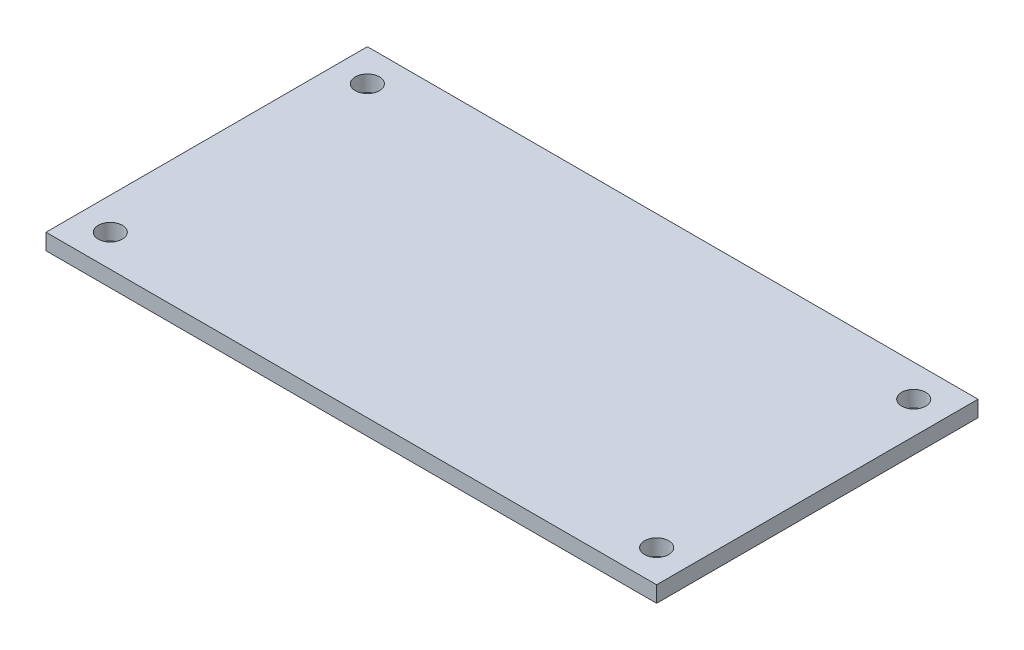
from build123d import *

# Parameters (mm, degrees)
SKETCH_1_W      = 76
SKETCH_1_H      = 40
SKETCH_1_R      = 1.5
EXTRUDE_1_DEPTH = 2


with BuildPart() as part:
    # 草图1 → 凸台-拉伸1 (new body)
    with BuildSketch(Plane(origin=(0, 0, 0), x_dir=(1, 0, 0), z_dir=(0, 1, 0))):
        Rectangle(SKETCH_1_W, SKETCH_1_H)
        with Locations(Location((34, 16, 0), (0, 0, 270))):
            Circle(SKETCH_1_R, mode=Mode.SUBTRACT)
        with Locations(Location((34, -16, 0), (0, 0, 90))):
            Circle(SKETCH_1_R, mode=Mode.SUBTRACT)
        with Locations(Location((-34, -16, 0), (0, 0, 270))):
            Circle(SKETCH_1_R, mode=Mode.SUBTRACT)
        with Locations(Location((-34, 16, 0), (0, 0, 90))):
            Circle(SKETCH_1_R, mode=Mode.SUBTRACT)
    extrude(amount=EXTRUDE_1_DEPTH)


solid = part.part
